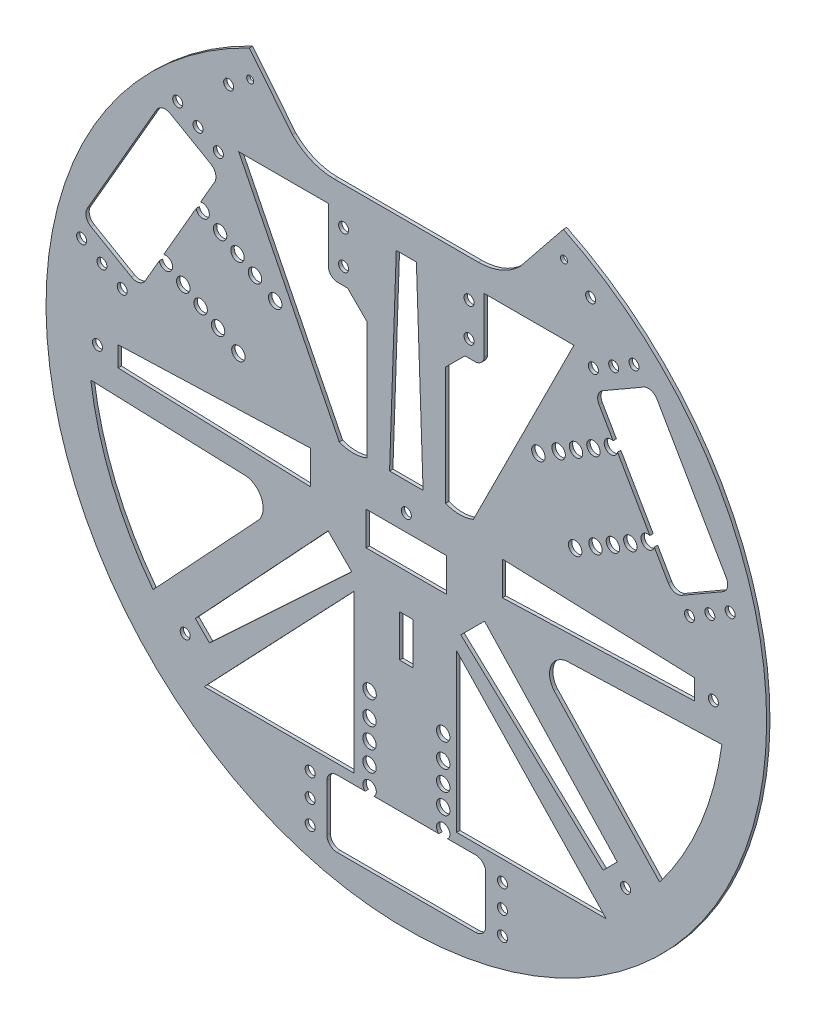
from build123d import *

# Parameters (mm, degrees)
CROQUIS1_R              = 1.5
CROQUIS1_R_2            = 2
CROQUIS1_W              = 4
CROQUIS1_H              = 12.5
CROQUIS1_W_2            = 24
CROQUIS1_H_2            = 10
CROQUIS1_R_3            = 1.05
SALIENTE_EXTRUIR1_DEPTH = 1


with BuildPart() as part:
    # Croquis1 → Saliente-Extruir1 (new body)
    with BuildSketch(Plane.XY):
        with BuildLine():
            Line((131.180364661, 90.354722454), (88.180364661, 90.354722454))
            ThreePointArc((88.180364661, 90.354722454), (81.415413409, 91.700354922), (75.680364661, 95.532391983))
            Line((75.680364661, 95.532391983), (62.822201018, 111.532391983))
            ThreePointArc((62.822201018, 111.532391983), (109.680364661, -92.717608017), (156.538528304, 111.532391983))
            Line((156.538528304, 111.532391983), (143.680364661, 95.532391983))
            ThreePointArc((143.680364661, 95.532391983), (137.945315913, 91.700354922), (131.180364661, 90.354722454))
        make_face()
        with Locations((43.71320158, -49.332008393)):
            Circle(CROQUIS1_R, mode=Mode.SUBTRACT)
        with Locations((80.996685363, -80.217608018)):
            Circle(CROQUIS1_R, mode=Mode.SUBTRACT)
        with Locations((80.996685363, -73.217608018)):
            Circle(CROQUIS1_R, mode=Mode.SUBTRACT)
        with Locations((80.996685363, -66.332008393)):
            Circle(CROQUIS1_R, mode=Mode.SUBTRACT)
        with Locations((98.680438553, -55.717556284)):
            Circle(CROQUIS1_R_2, mode=Mode.SUBTRACT)
        with Locations((98.680401106, -49.717556284)):
            Circle(CROQUIS1_R_2, mode=Mode.SUBTRACT)
        with Locations((98.680363659, -43.717556284)):
            Circle(CROQUIS1_R_2, mode=Mode.SUBTRACT)
        with BuildLine():
            ThreePointArc((34.116608966, -42.794676588), (21.911305314, -21.571317887), (15.535232528, 2.066492662))
            Line((15.535232528, 2.066492662), (61.894872201, 0.449477136))
            ThreePointArc((61.894872201, 0.449477136), (66.558020843, -3.198754977), (65.612772433, -9.043501186))
            Line((65.612772433, -9.043501186), (34.116608966, -42.794676588))
        make_face(mode=Mode.SUBTRACT)
        Polygon((93.996685363, -13.294999415), (93.996685363, -60.217584698), (49.369137605, -60.217584698), align=None, mode=Mode.SUBTRACT)
        Polygon((86.345840882, -1.481063984), (93.416908694, -8.552131796), (50.936072201, -48.150111542), (46.747861136, -43.907470855), align=None, mode=Mode.SUBTRACT)
        with Locations((98.720025602, -36.718077204)):
            Circle(CROQUIS1_R_2, mode=Mode.SUBTRACT)
        with BuildLine():
            ThreePointArc((119.361253173, -63.217422773), (120.684112016, -59.717418954), (122.007014547, -63.217406261))
            Line((122.007014547, -63.217406261), (130.364285363, -63.217608018))
            ThreePointArc((130.364285363, -63.217608018), (132.485605706, -64.096287674), (133.364285363, -66.217608018))
            Line((133.364285363, -66.217608018), (133.364285363, -80.217608018))
            ThreePointArc((133.364285363, -80.217608018), (132.485605706, -82.338928361), (130.364285363, -83.217608018))
            Line((130.364285363, -83.217608018), (88.996685363, -83.217608018))
            ThreePointArc((88.996685363, -83.217608018), (86.875365019, -82.338928361), (85.996685363, -80.217608018))
            Line((85.996685363, -80.217608018), (85.996685363, -66.217608018))
            ThreePointArc((85.996685363, -66.217608018), (86.875365019, -64.096287674), (88.996685363, -63.217608018))
            Line((88.996685363, -63.217608018), (97.396719595, -63.217559859))
            ThreePointArc((97.396719595, -63.217559859), (98.72016915, -59.718077203), (100.043662388, -63.217543339))
            Line((100.043662388, -63.217543339), (119.361253173, -63.217422773))
        make_face(mode=Mode.SUBTRACT)
        with Locations((138.364285363, -80.217608018)):
            Circle(CROQUIS1_R, mode=Mode.SUBTRACT)
        with Locations((138.364285363, -73.217608018)):
            Circle(CROQUIS1_R, mode=Mode.SUBTRACT)
        with Locations((120.684087051, -55.717418954)):
            Circle(CROQUIS1_R_2, mode=Mode.SUBTRACT)
        with Locations((120.684049603, -49.717418955)):
            Circle(CROQUIS1_R_2, mode=Mode.SUBTRACT)
        with Locations((120.684012156, -43.717418955)):
            Circle(CROQUIS1_R_2, mode=Mode.SUBTRACT)
        with Locations((138.364285363, -66.332008393)):
            Circle(CROQUIS1_R, mode=Mode.SUBTRACT)
        with Locations((175.109332581, -49.332008393)):
            Circle(CROQUIS1_R, mode=Mode.SUBTRACT)
        with Locations((120.680319973, -36.717940145)):
            Circle(CROQUIS1_R_2, mode=Mode.SUBTRACT)
        with Locations((109.680364661, -17.967608017)):
            Rectangle(CROQUIS1_W, CROQUIS1_H, mode=Mode.SUBTRACT)
        Polygon((169.30803312, -60.217584698), (124.680485362, -60.217584698), (124.680485362, -13.294999415), align=None, mode=Mode.SUBTRACT)
        Polygon((168.3702275, -48.150111542), (125.943820629, -8.552131796), (133.01488844, -1.481063984), (172.612868187, -43.907470855), align=None, mode=Mode.SUBTRACT)
        with Locations((109.680364661, 4.782391983)):
            Rectangle(CROQUIS1_W_2, CROQUIS1_H_2, mode=Mode.SUBTRACT)
        with BuildLine():
            ThreePointArc((203.825496795, 2.066492663), (197.449424008, -21.571317887), (185.244120357, -42.794676588))
            Line((185.244120357, -42.794676588), (153.747956889, -9.043501186))
            ThreePointArc((153.747956889, -9.043501186), (152.80270848, -3.198754977), (157.465857121, 0.449477136))
            Line((157.465857121, 0.449477136), (203.825496795, 2.066492663))
        make_face(mode=Mode.SUBTRACT)
        with Locations((17.528656348, 12.167991608)):
            Circle(CROQUIS1_R, mode=Mode.SUBTRACT)
        with Locations((18.860193539, 33.828931972)):
            Circle(CROQUIS1_R, mode=Mode.SUBTRACT)
        with Locations((24.922371366, 30.328931972)):
            Circle(CROQUIS1_R, mode=Mode.SUBTRACT)
        Polygon((23.680364661, 15.282391983), (81.020122904, 17.259625026), (81.020122904, 7.282391983), (23.680364661, 9.282391983), align=None, mode=Mode.SUBTRACT)
        with Locations((53.516278696, 34.502963822)):
            Circle(CROQUIS1_R_2, mode=Mode.SUBTRACT)
        with Locations((12.798015713, 37.328931972)):
            Circle(CROQUIS1_R, mode=Mode.SUBTRACT)
        with Locations((48.32010755, 37.502931391)):
            Circle(CROQUIS1_R_2, mode=Mode.SUBTRACT)
        with Locations((43.123936403, 40.502898961)):
            Circle(CROQUIS1_R_2, mode=Mode.SUBTRACT)
        with BuildLine():
            ThreePointArc((37.290159506, 45.398508614), (39.659822306, 42.502877341), (35.96729312, 43.107203795))
            Line((35.96729312, 43.107203795), (31.788482985, 35.869695841))
            ThreePointArc((31.788482985, 35.869695841), (29.966863909, 34.471918362), (27.690406774, 34.771619629))
            Line((27.690406774, 34.771619629), (15.566051121, 41.771619629))
            ThreePointArc((15.566051121, 41.771619629), (14.168273642, 43.593238705), (14.46797491, 45.869695841))
            Line((14.46797491, 45.869695841), (35.15177491, 81.695088334))
            ThreePointArc((35.15177491, 81.695088334), (36.973393986, 83.092865813), (39.249851121, 82.793164546))
            Line((39.249851121, 82.793164546), (51.374206774, 75.793164546))
            ThreePointArc((51.374206774, 75.793164546), (52.771984253, 73.97154547), (52.472282985, 71.695088334))
            Line((52.472282985, 71.695088334), (48.272307576, 64.420421217))
            ThreePointArc((48.272307576, 64.420421217), (50.641223678, 61.524538954), (46.948850486, 62.128093256))
            Line((46.948850486, 62.128093256), (37.290159506, 45.398508614))
        make_face(mode=Mode.SUBTRACT)
        with Locations((54.125641721, 59.5586862)):
            Circle(CROQUIS1_R_2, mode=Mode.SUBTRACT)
        with Locations((59.57985125, 31.006421941)):
            Circle(CROQUIS1_R_2, mode=Mode.SUBTRACT)
        with Locations((64.517984014, 53.558751061)):
            Circle(CROQUIS1_R_2, mode=Mode.SUBTRACT)
        with Locations((59.321812867, 56.558718631)):
            Circle(CROQUIS1_R_2, mode=Mode.SUBTRACT)
        with Locations((70.559879739, 50.02466327)):
            Circle(CROQUIS1_R_2, mode=Mode.SUBTRACT)
        with BuildLine():
            Line((89.680364661, 23.146247016), (59.680364661, 83.146247016))
            Line((59.680364661, 83.146247016), (86.420364661, 83.146247016))
            Line((86.420364661, 83.146247016), (86.420364661, 67.146247016))
            Line((86.420364661, 67.146247016), (86.420364661, 66.752258379))
            ThreePointArc((86.420364661, 66.752258379), (87.236457208, 64.962339563), (89.026376024, 64.146247016))
            Line((89.026376024, 64.146247016), (92.170364661, 64.146247016))
            Line((92.170364661, 64.146247016), (97.920364661, 58.396247016))
            Line((97.920364661, 58.396247016), (97.920364661, 23.146247016))
            ThreePointArc((97.920364661, 23.146247016), (93.800364661, 22.349215741), (89.680364661, 23.146247016))
        make_face(mode=Mode.SUBTRACT)
        with Locations((47.542931367, 83.508891189)):
            Circle(CROQUIS1_R, mode=Mode.SUBTRACT)
        with Locations((53.605109194, 80.008891189)):
            Circle(CROQUIS1_R, mode=Mode.SUBTRACT)
        with Locations((41.480753541, 87.008891189)):
            Circle(CROQUIS1_R, mode=Mode.SUBTRACT)
        with Locations((90.962064661, 69.156647016)):
            Circle(CROQUIS1_R, mode=Mode.SUBTRACT)
        with Locations((90.962064661, 79.156647016)):
            Circle(CROQUIS1_R, mode=Mode.SUBTRACT)
        with Locations((56.680364661, 98.977797379)):
            Circle(CROQUIS1_R, mode=Mode.SUBTRACT)
        with Locations((63.098080544, 103.49449437)):
            Circle(CROQUIS1_R_3, mode=Mode.SUBTRACT)
        with Locations((109.680364661, 14.782391983)):
            Circle(CROQUIS1_R, mode=Mode.SUBTRACT)
        with Locations((160.049902172, 30.893066258)):
            Circle(CROQUIS1_R_2, mode=Mode.SUBTRACT)
        Polygon((114.680364661, 23.146247016), (104.680364661, 23.146247016), (106.680364661, 81.146247016), (112.680364661, 81.146247016), align=None, mode=Mode.SUBTRACT)
        with BuildLine():
            Line((132.920364661, 83.146247016), (159.680364661, 83.146247016))
            Line((159.680364661, 83.146247016), (129.680364661, 23.146247016))
            ThreePointArc((129.680364661, 23.146247016), (125.550364661, 22.345482337), (121.420364661, 23.146247016))
            Line((121.420364661, 23.146247016), (121.420364661, 58.396247016))
            Line((121.420364661, 58.396247016), (127.170364661, 64.146247016))
            Line((127.170364661, 64.146247016), (129.920364661, 64.146247016))
            Line((129.920364661, 64.146247016), (130.32493914, 64.146247016))
            ThreePointArc((130.32493914, 64.146247016), (132.106097995, 64.960513683), (132.920364661, 66.741672538))
            Line((132.920364661, 66.741672538), (132.920364661, 67.146247016))
            Line((132.920364661, 67.146247016), (132.920364661, 83.146247016))
        make_face(mode=Mode.SUBTRACT)
        with Locations((149.069873683, 49.911307587)):
            Circle(CROQUIS1_R_2, mode=Mode.SUBTRACT)
        with Locations((155.111769409, 53.445395378)):
            Circle(CROQUIS1_R_2, mode=Mode.SUBTRACT)
        with Locations((160.307940555, 56.445362947)):
            Circle(CROQUIS1_R_2, mode=Mode.SUBTRACT)
        Polygon((195.676269047, 15.223811234), (195.676269047, 9.223811234), (138.336469047, 7.223811234), (138.336469047, 17.223811234), align=None, mode=Mode.SUBTRACT)
        with Locations((166.113474726, 34.389608138)):
            Circle(CROQUIS1_R_2, mode=Mode.SUBTRACT)
        with Locations((201.293857432, 12.167991608)):
            Circle(CROQUIS1_R, mode=Mode.SUBTRACT)
        with Locations((194.170563951, 30.44149261)):
            Circle(CROQUIS1_R, mode=Mode.SUBTRACT)
        with Locations((200.232741778, 33.94149261)):
            Circle(CROQUIS1_R, mode=Mode.SUBTRACT)
        with Locations((171.309645873, 37.389575708)):
            Circle(CROQUIS1_R_2, mode=Mode.SUBTRACT)
        with Locations((176.505817019, 40.389543277)):
            Circle(CROQUIS1_R_2, mode=Mode.SUBTRACT)
        with Locations((165.504111701, 59.445330517)):
            Circle(CROQUIS1_R_2, mode=Mode.SUBTRACT)
        with BuildLine():
            Line((182.339593916, 45.28515293), (172.680902936, 62.014737573))
            ThreePointArc((172.680902936, 62.014737573), (168.988529744, 61.41118327), (171.357445846, 64.307065534))
            Line((171.357445846, 64.307065534), (167.15778532, 71.580687959))
            ThreePointArc((167.15778532, 71.580687959), (166.858084053, 73.857145094), (168.255861532, 75.67876417))
            Line((168.255861532, 75.67876417), (180.380217185, 82.67876417))
            ThreePointArc((180.380217185, 82.67876417), (182.65667432, 82.978465438), (184.478293396, 81.580687959))
            Line((184.478293396, 81.580687959), (205.161031224, 45.757135202))
            ThreePointArc((205.161031224, 45.757135202), (205.460732491, 43.480678067), (204.062955012, 41.65905899))
            Line((204.062955012, 41.65905899), (191.938599359, 34.65905899))
            ThreePointArc((191.938599359, 34.65905899), (189.662142224, 34.359357723), (187.840523148, 35.757135202))
            Line((187.840523148, 35.757135202), (183.662460302, 42.993848112))
            ThreePointArc((183.662460302, 42.993848112), (179.969931116, 42.389521657), (182.339593916, 45.28515293))
        make_face(mode=Mode.SUBTRACT)
        with Locations((206.294919604, 37.44149261)):
            Circle(CROQUIS1_R, mode=Mode.SUBTRACT)
        with Locations((128.398664661, 69.156647016)):
            Circle(CROQUIS1_R, mode=Mode.SUBTRACT)
        with Locations((128.398664661, 79.156647016)):
            Circle(CROQUIS1_R, mode=Mode.SUBTRACT)
        with Locations((156.717834335, 103.807875278)):
            Circle(CROQUIS1_R_3, mode=Mode.SUBTRACT)
        with Locations((165.486763951, 80.123291565)):
            Circle(CROQUIS1_R, mode=Mode.SUBTRACT)
        with Locations((171.548941778, 83.623291565)):
            Circle(CROQUIS1_R, mode=Mode.SUBTRACT)
        with Locations((164.680364661, 97.977797379)):
            Circle(CROQUIS1_R, mode=Mode.SUBTRACT)
        with Locations((177.611119604, 87.123291565)):
            Circle(CROQUIS1_R, mode=Mode.SUBTRACT)
    extrude(amount=SALIENTE_EXTRUIR1_DEPTH)


solid = part.part
